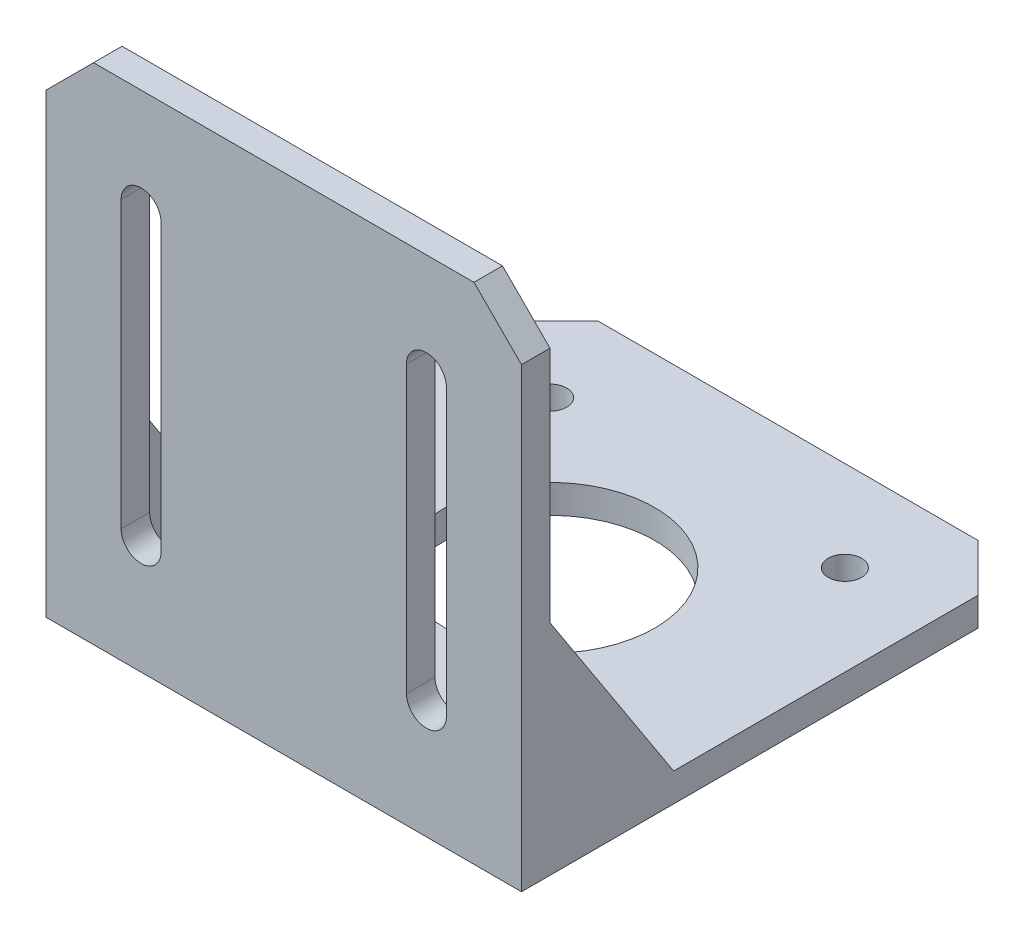
from build123d import *

# Parameters (mm, degrees)
SKETCH_1_R      = 11
SKETCH_1_R_2    = 1.75
EXTRUDE_1_DEPTH = 3
EXTRUDE_2_DEPTH = 3
EXTRUDE_3_DEPTH = 3
EXTRUDE_4_DEPTH = 3


with BuildPart() as part:
    # 草图1 → 凸台-拉伸1 (new body)
    with BuildSketch(Plane(origin=(0, 0, 0), x_dir=(1, 0, 0), z_dir=(0, 1, 0))):
        Polygon((0, 0), (50, 0), (50, 45), (45, 50), (5, 50), (0, 45), align=None)
        with Locations(Location((25, 25, 0), (0, 0, 270))):
            Circle(SKETCH_1_R, mode=Mode.SUBTRACT)
        with Locations(Location((9.5, 40.5, 0), (0, 0, 270))):
            Circle(SKETCH_1_R_2, mode=Mode.SUBTRACT)
        with Locations(Location((40.5, 40.5, 0), (0, 0, 90))):
            Circle(SKETCH_1_R_2, mode=Mode.SUBTRACT)
        with Locations(Location((40.5, 9.5, 0), (0, 0, 270))):
            Circle(SKETCH_1_R_2, mode=Mode.SUBTRACT)
        with Locations(Location((9.5, 9.5, 0), (0, 0, 90))):
            Circle(SKETCH_1_R_2, mode=Mode.SUBTRACT)
    extrude(amount=EXTRUDE_1_DEPTH)

    # 草图2 → 凸台-拉伸2 (add)
    with BuildSketch(Plane.XY):
        Polygon((0, 0), (50, 0), (50, 48), (45, 53), (5, 53), (0, 48), align=None)
        with BuildLine():
            Line((7.9, 42), (7.9, 12))
            ThreePointArc((7.9, 12), (10, 9.9), (12.1, 12))
            Line((12.1, 12), (12.1, 42))
            ThreePointArc((12.1, 42), (10, 44.1), (7.9, 42))
        make_face(mode=Mode.SUBTRACT)
        with BuildLine():
            Line((37.9, 42), (37.9, 12))
            ThreePointArc((37.9, 12), (40, 9.9), (42.1, 12))
            Line((42.1, 12), (42.1, 42))
            ThreePointArc((42.1, 42), (40, 44.1), (37.9, 42))
        make_face(mode=Mode.SUBTRACT)
    extrude(amount=EXTRUDE_2_DEPTH)

    # 草图3 → 凸台-拉伸3 (add)
    with BuildSketch(Plane.ZY):
        Polygon((0, 3), (-13, 3), (0, 23), align=None)
    extrude(amount=-EXTRUDE_3_DEPTH)

    # 草图4 → 凸台-拉伸4 (add)
    with BuildSketch(Plane(origin=(50, 0, 0), x_dir=(0, 0, -1), z_dir=(1, 0, 0))):
        Polygon((0, 3), (13, 3), (0, 23), align=None)
    extrude(amount=-EXTRUDE_4_DEPTH)


solid = part.part
